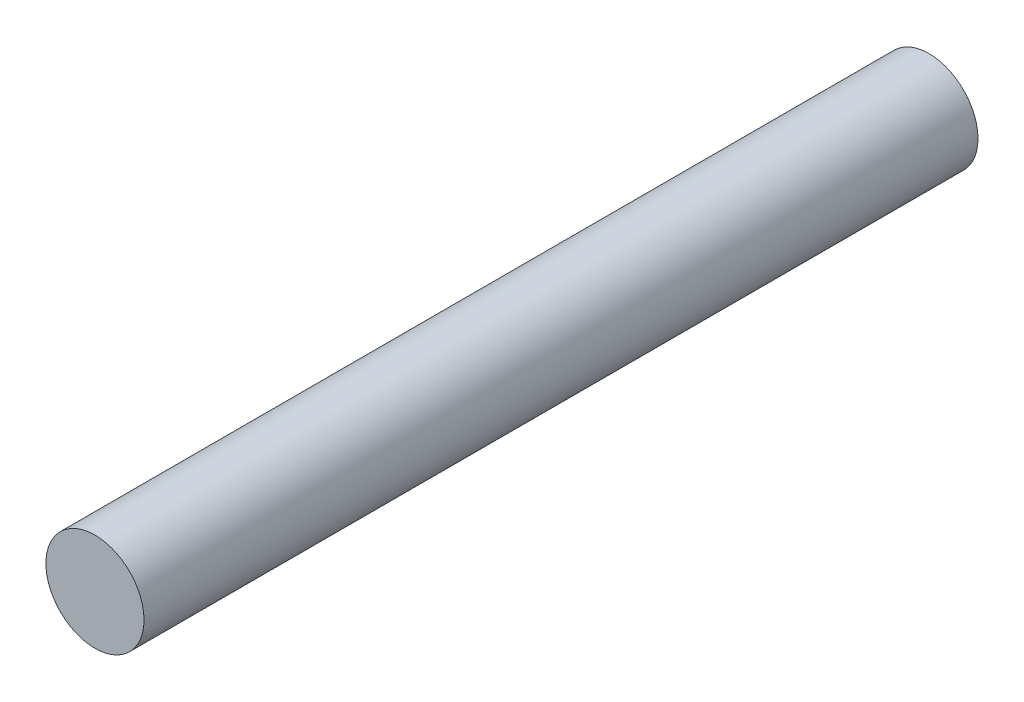
from build123d import *

# Parameters (mm, degrees)
SKETCH1_R           = 12.7
BOSS_EXTRUDE1_DEPTH = 215.9


with BuildPart() as part:
    # Sketch1 → Boss-Extrude1 (new body)
    with BuildSketch(Plane.XY):
        Circle(SKETCH1_R)
    extrude(amount=BOSS_EXTRUDE1_DEPTH)


solid = part.part
